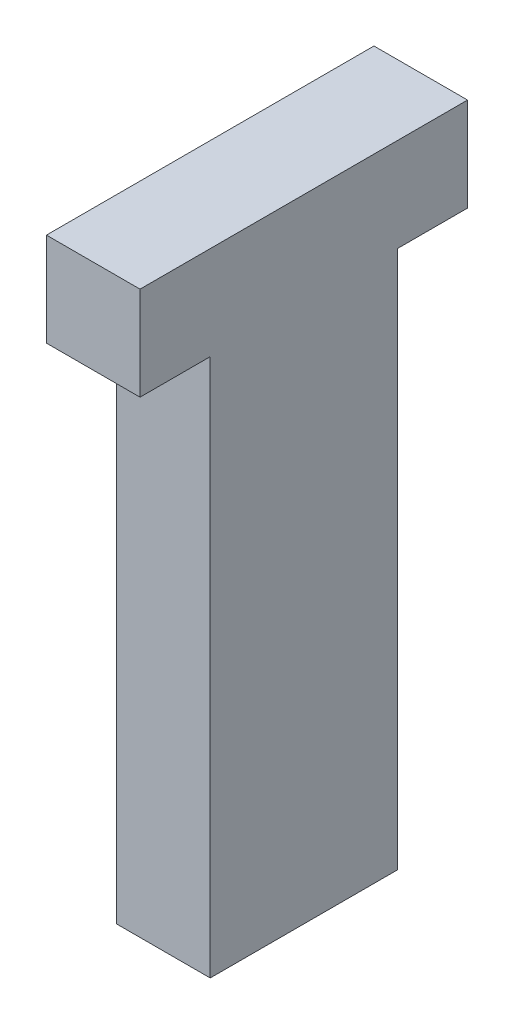
from build123d import *

# Parameters (mm, degrees)
SKETCH1_W           = 10
SKETCH1_H           = 20
BOSS_EXTRUDE1_DEPTH = 57.5
BOSS_EXTRUDE2_DEPTH = 10


with BuildPart() as part:
    # Sketch1 → Boss-Extrude1 (new body)
    with BuildSketch(Plane(origin=(0, 0, 0), x_dir=(1, 0, 0), z_dir=(0, 1, 0))):
        with Locations((-5, 10)):
            Rectangle(SKETCH1_W, SKETCH1_H)
    extrude(amount=BOSS_EXTRUDE1_DEPTH)

    # Sketch3 → Boss-Extrude2 (add)
    with BuildSketch(Plane(origin=(0, 57.5, 0), x_dir=(1, 0, 0), z_dir=(0, 1, 0))):
        Polygon((-10, 10), (-10, 27.5), (0, 27.5), (0, 0), (0, -7.5), (-10, -7.5), align=None)
    extrude(amount=BOSS_EXTRUDE2_DEPTH)


solid = part.part
